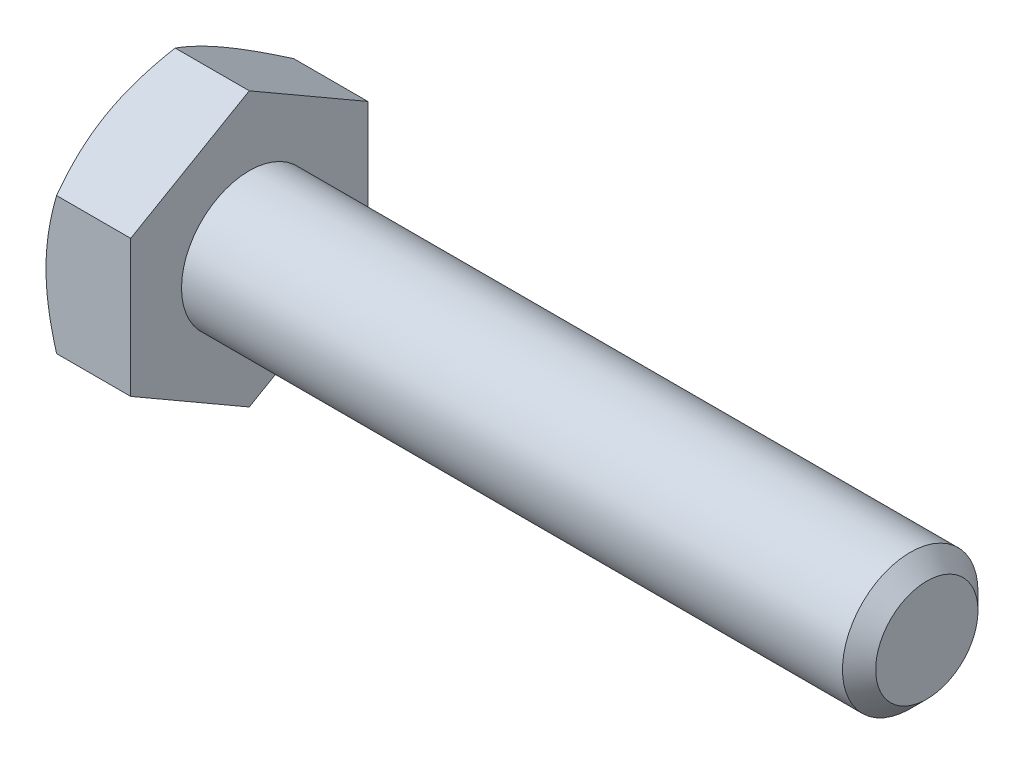
from build123d import *

# Parameters (mm, degrees)
SKETCH5_R           = 3.175
BOSS_EXTRUDE3_DEPTH = 31.75
CHAMFER1_SIZE       = 0.77724
BOSS_EXTRUDE4_DEPTH = 3.96875
SKETCH8_OUTSIDE_W   = 151.664
SKETCH8_OUTSIDE_H   = 153.384
SKETCH8_OUTSIDE_R   = 5.55625
CUT_EXTRUDE3_DEPTH  = 37.713261469
CUT_EXTRUDE3_DRAFT  = -60
CUT_EXTRUDE4_DEPTH  = 0.254
CIRPATTERN1_COUNT   = 3


with BuildPart() as part:
    # Sketch5 → Boss-Extrude3 (new body)
    with BuildSketch(Plane(origin=(17.859375, 0, 0), x_dir=(0, 0, -1), z_dir=(1, 0, 0))):
        Circle(SKETCH5_R)
    extrude(amount=-BOSS_EXTRUDE3_DEPTH)

    # Chamfer1
    chamfer1_edges = [part.edges().sort_by_distance(p)[0] for p in [
        (17.859375, 0, 3.175),
    ]]
    chamfer(chamfer1_edges, length=CHAMFER1_SIZE)

    # Sketch6 → Boss-Extrude4 (add)
    with BuildSketch(Plane.ZY.offset(13.890625)):
        Polygon((5.55625, 3.207902433), (0, 6.415804866), (-5.55625, 3.207902433), (-5.55625, -3.207902433), (0, -6.415804866), (5.55625, -3.207902433), align=None)
    extrude(amount=BOSS_EXTRUDE4_DEPTH)


with BuildPart() as cut_extrude3_tool:
    # Sketch8 outside → Cut-Extrude3 (with draft: the straight prism first)
    with BuildSketch(Plane.ZY.offset(17.859375)):
        Rectangle(SKETCH8_OUTSIDE_W, SKETCH8_OUTSIDE_H)
        Circle(SKETCH8_OUTSIDE_R, mode=Mode.SUBTRACT)
    extrude(amount=-CUT_EXTRUDE3_DEPTH)
    # Cut-Extrude3: the draft: its side faces are tilted about the plane it starts from
    cut_extrude3_sides = [cut_extrude3_tool.faces().sort_by_distance(p)[0] for p in [
        (0.997255735, -76.692, 0),
        (0.997255735, 0, 75.832),
        (0.997255735, 76.692, 0),
        (0.997255735, 0, -75.832),
        (0.997255735, 0, -5.55625),
    ]]
    draft(cut_extrude3_sides, Plane.ZY.offset(17.859375), CUT_EXTRUDE3_DRAFT)


with BuildPart() as part_1:
    add(part.part)

    # Cut-Extrude3: cut by cut_extrude3_tool
    add(cut_extrude3_tool.part, mode=Mode.SUBTRACT)

    # Sketch12 → Cut-Extrude4 (cut)
    with BuildSketch(Plane.ZY.offset(17.859375)):
        with BuildLine():
            Line((0.1666875, 4.2783125), (0.1666875, 2.3891875))
            ThreePointArc((0.1666875, 2.3891875), (0, 2.2225), (-0.1666875, 2.3891875))
            Line((-0.1666875, 2.3891875), (-0.1666875, 4.2783125))
            ThreePointArc((-0.1666875, 4.2783125), (0, 4.445), (0.1666875, 4.2783125))
        make_face()
    cut_extrude4 = extrude(amount=-CUT_EXTRUDE4_DEPTH, mode=Mode.SUBTRACT)

    # CirPattern1: Cut-Extrude4 ×3 about axis
    cirpattern1_axis = Axis((0, 0, 0), (1, 0, 0))
    for i in range(1, CIRPATTERN1_COUNT):
        add(cut_extrude4.rotate(cirpattern1_axis, i * 360 / CIRPATTERN1_COUNT), mode=Mode.SUBTRACT)


solid = part_1.part
